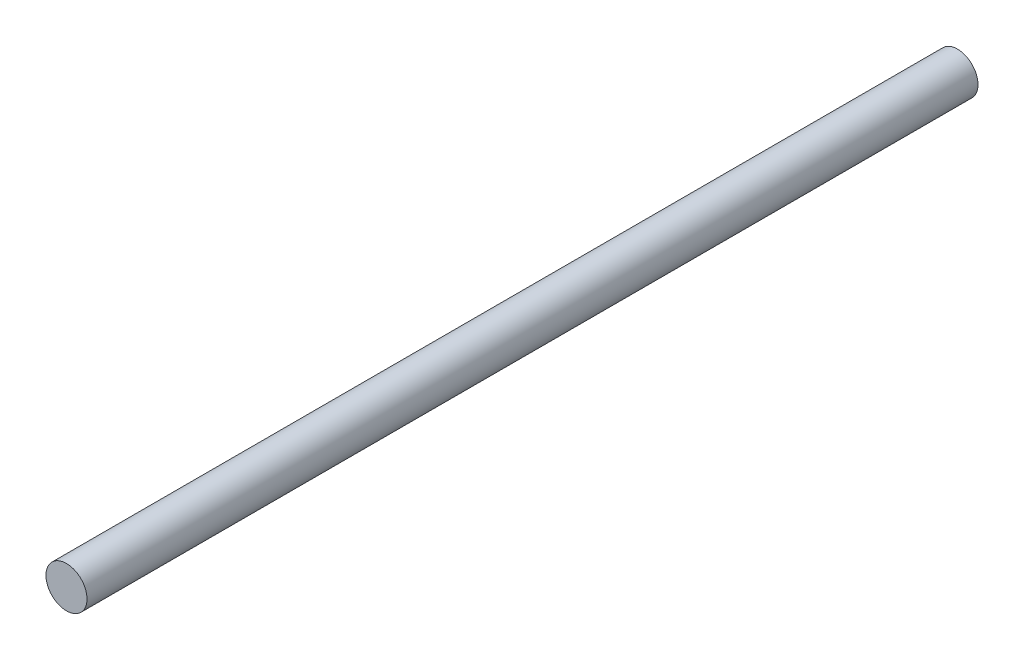
from build123d import *

# Parameters (mm, degrees)
SZKIC1_R                    = 5
DODANIE_WYCI_GNI_CIE1_DEPTH = 217


with BuildPart() as part:
    # Szkic1 → Dodanie-wyciągnięcie1 (new body)
    with BuildSketch(Plane.XY):
        Circle(SZKIC1_R)
    extrude(amount=DODANIE_WYCI_GNI_CIE1_DEPTH)


solid = part.part
